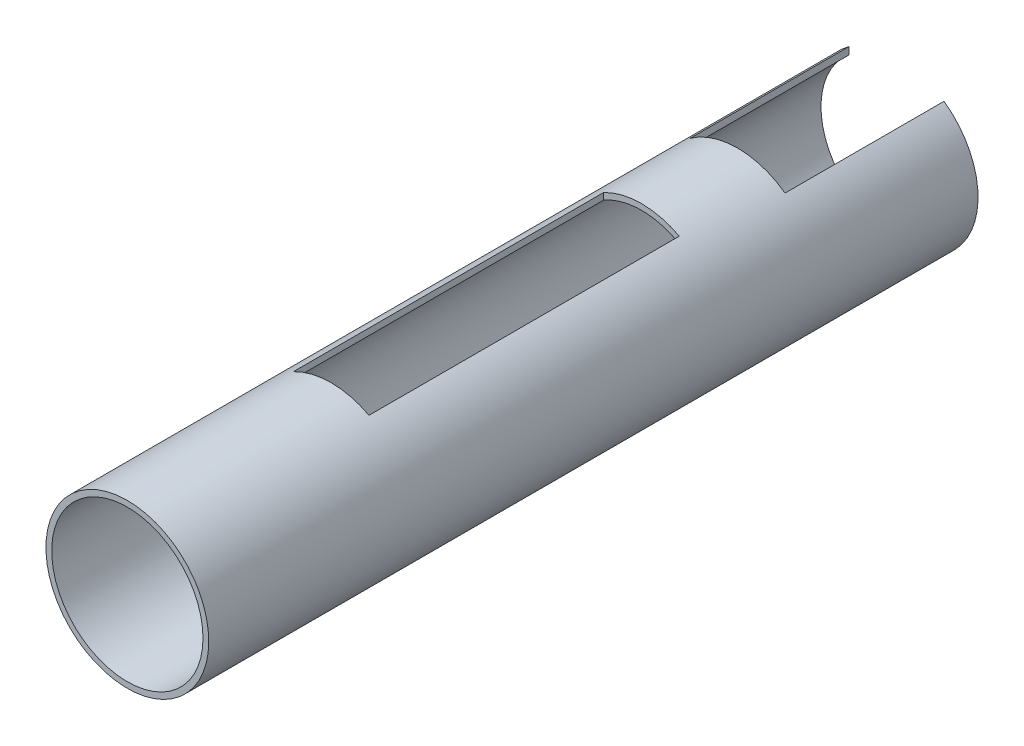
from build123d import *

# Parameters (mm, degrees)
SKETCH1_R               = 31.75
SKETCH1_R_2             = 29.5
BOSS_EXTRUDE1_DEPTH     = 300
CUT_EXTRUDE1_REACH      = 305.342
CUT_EXTRUDE1_END_RADIUS = 31.75
SKETCH2_W               = 37
SKETCH2_H               = 62
CUT_EXTRUDE2_DEPTH      = 304.341597873
CUT_EXTRUDE2_DEPTH_BACK = 304.341597873
SKETCH4_W               = 29.5
SKETCH4_H               = 121


with BuildPart() as part:
    # Sketch1 → Boss-Extrude1 (new body)
    with BuildSketch(Plane.XY):
        Circle(SKETCH1_R)
        Circle(SKETCH1_R_2, mode=Mode.SUBTRACT)
    extrude(amount=BOSS_EXTRUDE1_DEPTH)

    # Cut-Extrude1: up to this cylinder (the profile starts inside it)
    cut_extrude1_end = Plane(origin=(0, 0, 31), z_dir=(0, 0, -1)) * Cylinder(CUT_EXTRUDE1_END_RADIUS, 675.184, mode=Mode.PRIVATE)
    # Sketch2 → Cut-Extrude1 (cut, up to the surface)
    with BuildSketch(Plane(origin=(0, 0, 0), x_dir=(1, 0, 0), z_dir=(0, 1, 0)), mode=Mode.PRIVATE) as cut_extrude1_sk1:
        with Locations((0, -31)):
            Rectangle(SKETCH2_W, SKETCH2_H)
    cut_extrude1_tool1 = extrude(cut_extrude1_sk1.sketch, amount=CUT_EXTRUDE1_REACH, mode=Mode.PRIVATE) & cut_extrude1_end
    add(cut_extrude1_tool1.solids().sort_by_distance((0, 0, 31))[0], mode=Mode.SUBTRACT)

    # Sketch4 → Cut-Extrude2 (cut, two sides: drawn at the far end of the back side and taken through both)
    with BuildSketch(Plane(origin=(0, 0, 0), x_dir=(1, 0, 0), z_dir=(0, 1, 0)).offset(-CUT_EXTRUDE2_DEPTH_BACK)):
        with Locations((0, -160)):
            Rectangle(SKETCH4_W, SKETCH4_H)
    extrude(amount=CUT_EXTRUDE2_DEPTH + CUT_EXTRUDE2_DEPTH_BACK, mode=Mode.SUBTRACT)


solid = part.part
